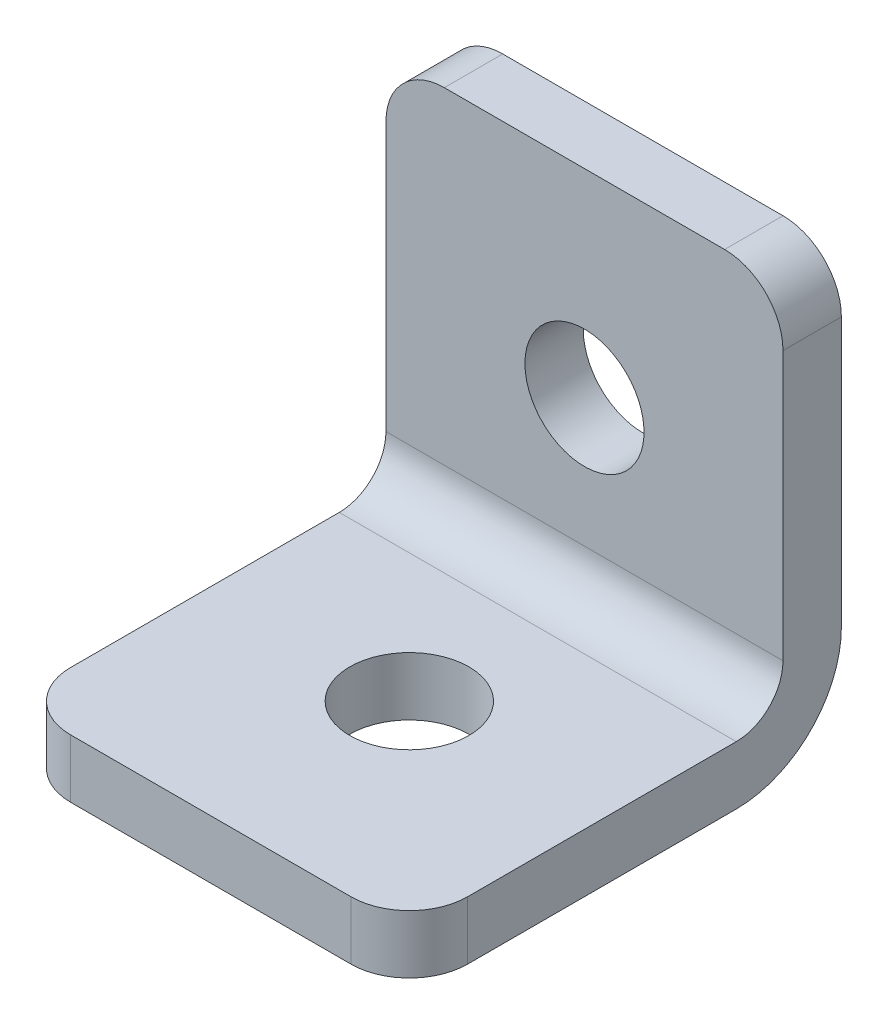
from build123d import *

# Parameters (mm, degrees)
EXTRUDE_1_DEPTH     = 17
FILLET_1_R          = 2.5
SKETCH_2_R          = 2.55
CUT_EXTRUDE_1_DEPTH = 17
SKETCH_3_R          = 2.55
CUT_EXTRUDE_2_DEPTH = 17


with BuildPart() as part:
    # Эскиз1 → Бобышка-Вытянуть1 (new body)
    with BuildSketch(Plane(origin=(0, 0, 0), x_dir=(0, 0, -1), z_dir=(1, 0, 0))):
        with BuildLine():
            Line((14, 2.5), (0, 2.5))
            Line((0, 2.5), (0, 0))
            Line((0, 0), (14, 0))
            ThreePointArc((14, 0), (17.181980515, 1.318019485), (18.5, 4.5))
            Line((18.5, 4.5), (18.5, 18.5))
            Line((18.5, 18.5), (16, 18.5))
            Line((16, 18.5), (16, 4.5))
            ThreePointArc((16, 4.5), (15.414213562, 3.085786438), (14, 2.5))
        make_face()
    extrude(amount=EXTRUDE_1_DEPTH)

    # Скругление1
    fillet_1_edges = [part.edges().sort_by_distance(p)[0] for p in [
        (0, 1.25, 0),
        (17, 18.5, -17.25),
        (17, 1.25, 0),
        (0, 18.5, -17.25),
    ]]
    fillet(fillet_1_edges, radius=FILLET_1_R)

    # Эскиз2 → Вырез-Вытянуть1 (cut)
    with BuildSketch(Plane.XZ):
        with Locations(Location((8.5, -8.5, 0), (0, 0, 270))):
            Circle(SKETCH_2_R)
    extrude(amount=-CUT_EXTRUDE_1_DEPTH, mode=Mode.SUBTRACT)

    # Эскиз3 → Вырез-Вытянуть2 (cut)
    with BuildSketch(Plane(origin=(0, 0, -18.5), x_dir=(-1, 0, 0), z_dir=(0, 0, -1))):
        with Locations((-8.5, 10)):
            Circle(SKETCH_3_R)
    extrude(amount=-CUT_EXTRUDE_2_DEPTH, mode=Mode.SUBTRACT)


solid = part.part
